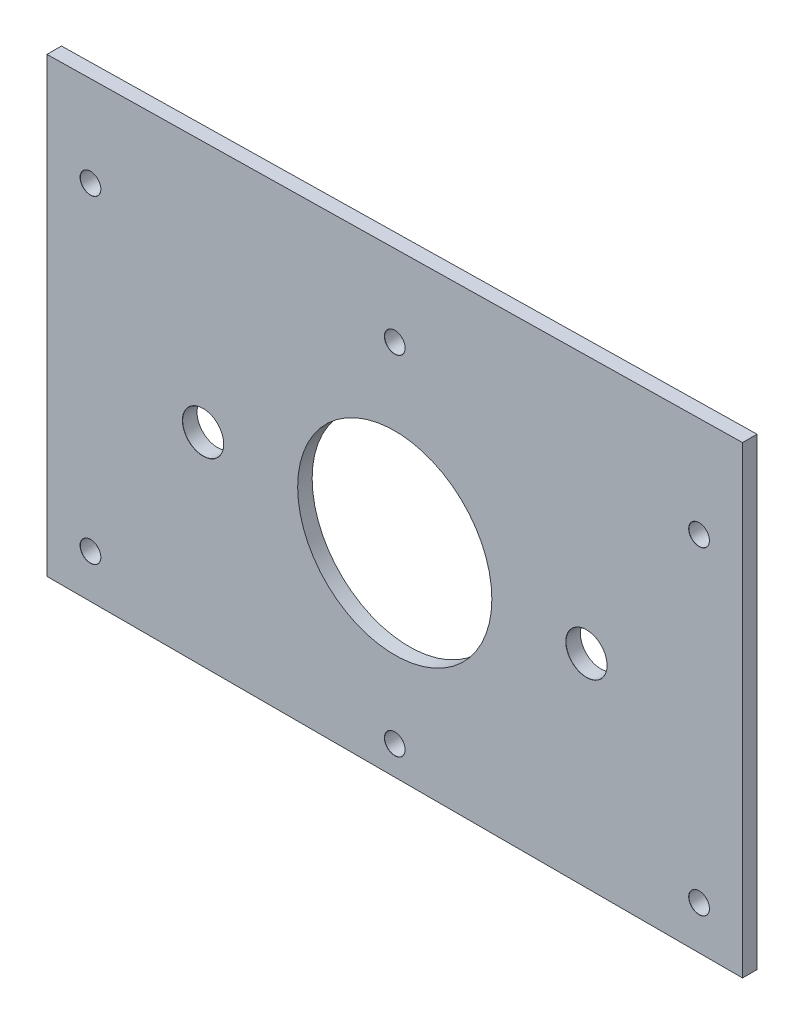
from build123d import *

# Parameters (mm, degrees)
BOSS_EXTRUDE1_DEPTH            = 3.175
M4_CLEARANCE_HOLE1_D           = 4.5
M4_CLEARANCE_HOLE1_CSINK_D     = 4.55
M4_CLEARANCE_HOLE1_CSINK_ANGLE = 90
M8_CLEARANCE_HOLE1_AT_2_COUNT  = 2
M8_CLEARANCE_HOLE1_AT_2_PITCH  = 84
SKETCH9_R                      = 21.275
CENTER_HOLE_DEPTH              = 96.302901976


with BuildPart() as part:
    # Sketch1 → Boss-Extrude1 (new body)
    with BuildSketch(Plane.XY):
        Polygon((-76.2, 54.61), (-76.2, 44.45), (-76.2, -44.45), (76.2, -44.45), (76.2, 44.45), (76.2, 57.15), align=None)
    extrude(amount=BOSS_EXTRUDE1_DEPTH)

    # M4 Clearance Hole1 (through all)
    with Locations(Plane.XY.offset(3.175)):
        with Locations((0, 38.1), (-66.675, 34.925), (-66.675, -34.925), (0, -38.1), (66.675, -34.925), (66.675, 34.925)):
            CounterSinkHole(M4_CLEARANCE_HOLE1_D / 2, M4_CLEARANCE_HOLE1_CSINK_D / 2, counter_sink_angle=M4_CLEARANCE_HOLE1_CSINK_ANGLE)

    # Sketch11 → M8 Clearance Hole1 (revolve, cut)
    with BuildSketch(Plane(origin=(-42, 0, 3.175), x_dir=(0, -1, 0), z_dir=(1, 0, 0))):
        Polygon((0, 0), (0, 3.175), (4.5, 3.175), (4.5, 0.025), (4.525, 0), align=None)
    m8_clearance_hole1 = revolve(axis=Axis((-42, 0, 9.525), (0, 0, -1)), mode=Mode.SUBTRACT)

    # M8 Clearance Hole1 at 2: M8 Clearance Hole1 ×2
    with Locations(*[(i * M8_CLEARANCE_HOLE1_AT_2_PITCH, 0, 0) for i in range(1, M8_CLEARANCE_HOLE1_AT_2_COUNT)]):
        add(m8_clearance_hole1, mode=Mode.SUBTRACT)

    # Sketch9 → Center Hole (cut, through all)
    with BuildSketch(Plane.XY.offset(3.175)):
        Circle(SKETCH9_R)
    extrude(amount=-CENTER_HOLE_DEPTH, mode=Mode.SUBTRACT)


solid = part.part
